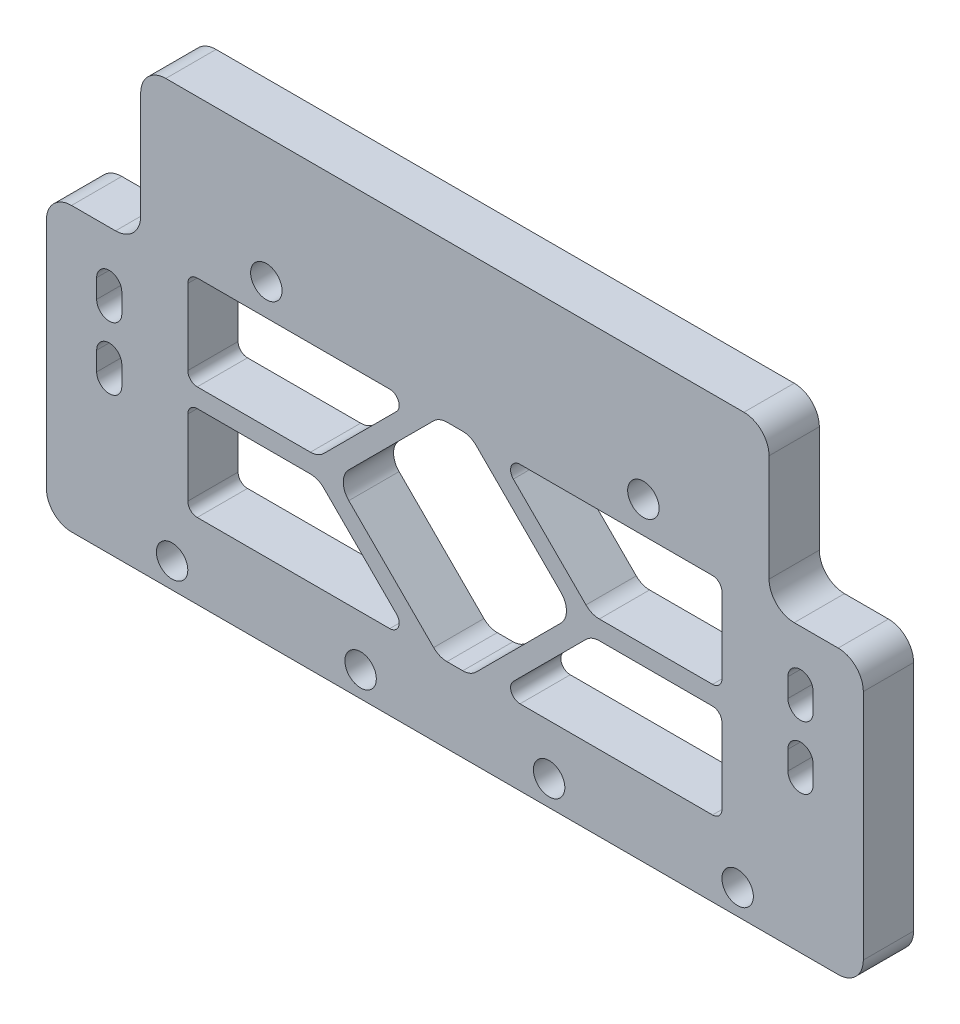
from build123d import *

# Parameters (mm, degrees)
BOSS_EXTRU_1_DEPTH      = 8
ESQUISSE2_R             = 2.5
ENL_V_MAT_EXTRU_1_DEPTH = 96.859271852
ENL_V_MAT_EXTRU_4_DEPTH = 96.859271852
ESQUISSE5_R             = 2.5
ENL_V_MAT_EXTRU_5_DEPTH = 96.859271852
ENL_V_MAT_EXTRU_6_DEPTH = 96.859271852


with BuildPart() as part:
    # Esquisse1 → Boss.-Extru.1 (new body)
    with BuildSketch(Plane.XY):
        with BuildLine():
            Line((65, 4), (65, 41))
            ThreePointArc((65, 41), (63.828427125, 43.828427125), (61, 45))
            Line((61, 45), (54, 45))
            ThreePointArc((54, 45), (51.171572875, 46.171572875), (50, 49))
            Line((50, 49), (50, 66))
            ThreePointArc((50, 66), (48.828427125, 68.828427125), (46, 70))
            Line((46, 70), (-46, 70))
            ThreePointArc((-46, 70), (-48.828427125, 68.828427125), (-50, 66))
            Line((-50, 66), (-50, 49))
            ThreePointArc((-50, 49), (-51.171572875, 46.171572875), (-54, 45))
            Line((-54, 45), (-61, 45))
            ThreePointArc((-61, 45), (-63.828427125, 43.828427125), (-65, 41))
            Line((-65, 41), (-65, 4))
            ThreePointArc((-65, 4), (-63.828427125, 1.171572875), (-61, 0))
            Line((-61, 0), (61, 0))
            ThreePointArc((61, 0), (63.828427125, 1.171572875), (65, 4))
        make_face()
    extrude(amount=BOSS_EXTRU_1_DEPTH)

    # Esquisse2 → Enlèv. mat.-Extru.1 (cut, through all)
    with BuildSketch(Plane.XY.offset(8)):
        with Locations((30, 50)):
            Circle(ESQUISSE2_R)
        with Locations(Location((-30, 50, 0), (0, 0, 180))):
            Circle(ESQUISSE2_R)
    extrude(amount=-ENL_V_MAT_EXTRU_1_DEPTH, mode=Mode.SUBTRACT)

    # Esquisse4 → Enlèv. mat.-Extru.4 (cut, through all)
    with BuildSketch(Plane.XY.offset(8)):
        with BuildLine():
            Line((-41, 45), (-10.363961031, 45))
            ThreePointArc((-10.363961031, 45), (-8.978141732, 44.074025149), (-9.303300859, 42.439339828))
            Line((-9.303300859, 42.439339828), (-20.863961031, 30.878679656))
            ThreePointArc((-20.863961031, 30.878679656), (-21.837231077, 30.228361402), (-22.985281374, 30))
            Line((-22.985281374, 30), (-41, 30))
            ThreePointArc((-41, 30), (-42.060660172, 30.439339828), (-42.5, 31.5))
            Line((-42.5, 31.5), (-42.5, 43.5))
            ThreePointArc((-42.5, 43.5), (-42.060660172, 44.560660172), (-41, 45))
        make_face()
        with BuildLine():
            Line((-41, 12), (-10.363961031, 12))
            ThreePointArc((-10.363961031, 12), (-8.978141732, 12.925974851), (-9.303300859, 14.560660172))
            Line((-9.303300859, 14.560660172), (-20.863961031, 26.121320344))
            ThreePointArc((-20.863961031, 26.121320344), (-21.837231077, 26.771638598), (-22.985281374, 27))
            Line((-22.985281374, 27), (-41, 27))
            ThreePointArc((-41, 27), (-42.060660172, 26.560660172), (-42.5, 25.5))
            Line((-42.5, 25.5), (-42.5, 13.5))
            ThreePointArc((-42.5, 13.5), (-42.060660172, 12.439339828), (-41, 12))
        make_face()
        with BuildLine():
            Line((42.5, 43.5), (42.5, 31.5))
            ThreePointArc((42.5, 31.5), (42.060660172, 30.439339828), (41, 30))
            Line((41, 30), (22.985281374, 30))
            ThreePointArc((22.985281374, 30), (21.837231077, 30.228361402), (20.863961031, 30.878679656))
            Line((20.863961031, 30.878679656), (9.303300859, 42.439339828))
            ThreePointArc((9.303300859, 42.439339828), (8.978141732, 44.074025149), (10.363961031, 45))
            Line((10.363961031, 45), (41, 45))
            ThreePointArc((41, 45), (42.060660172, 44.560660172), (42.5, 43.5))
        make_face()
        with BuildLine():
            Line((22.985281374, 27), (41, 27))
            ThreePointArc((41, 27), (42.060660172, 26.560660172), (42.5, 25.5))
            Line((42.5, 25.5), (42.5, 13.5))
            ThreePointArc((42.5, 13.5), (42.060660172, 12.439339828), (41, 12))
            Line((41, 12), (10.363961031, 12))
            ThreePointArc((10.363961031, 12), (8.978141732, 12.925974851), (9.303300859, 14.560660172))
            Line((9.303300859, 14.560660172), (20.863961031, 26.121320344))
            ThreePointArc((20.863961031, 26.121320344), (21.837231077, 26.771638598), (22.985281374, 27))
        make_face()
        with BuildLine():
            Line((-3.378679656, 44.121320344), (-16.878679656, 30.621320344))
            ThreePointArc((-16.878679656, 30.621320344), (-17.757359313, 28.5), (-16.878679656, 26.378679656))
            Line((-16.878679656, 26.378679656), (-3.378679656, 12.878679656))
            ThreePointArc((-3.378679656, 12.878679656), (-2.40540961, 12.228361402), (-1.257359313, 12))
            Line((-1.257359313, 12), (1.257359313, 12))
            ThreePointArc((1.257359313, 12), (2.40540961, 12.228361402), (3.378679656, 12.878679656))
            Line((3.378679656, 12.878679656), (16.878679656, 26.378679656))
            ThreePointArc((16.878679656, 26.378679656), (17.757359313, 28.5), (16.878679656, 30.621320344))
            Line((16.878679656, 30.621320344), (3.378679656, 44.121320344))
            ThreePointArc((3.378679656, 44.121320344), (2.40540961, 44.771638598), (1.257359313, 45))
            Line((1.257359313, 45), (-1.257359313, 45))
            ThreePointArc((-1.257359313, 45), (-2.40540961, 44.771638598), (-3.378679656, 44.121320344))
        make_face()
    extrude(amount=-ENL_V_MAT_EXTRU_4_DEPTH, mode=Mode.SUBTRACT)

    # Esquisse5 → Enlèv. mat.-Extru.5 (cut, through all)
    with BuildSketch(Plane.XY.offset(8)):
        with Locations((-45, 4)):
            Circle(ESQUISSE5_R)
        with Locations((-15, 4)):
            Circle(ESQUISSE5_R)
        with Locations((15, 4)):
            Circle(ESQUISSE5_R)
        with Locations((45, 4)):
            Circle(ESQUISSE5_R)
    extrude(amount=-ENL_V_MAT_EXTRU_5_DEPTH, mode=Mode.SUBTRACT)

    # Esquisse6 → Enlèv. mat.-Extru.6 (cut, through all)
    with BuildSketch(Plane.XY.offset(8)):
        with BuildLine():
            Line((57, 27.053539967), (57, 24.053539967))
            ThreePointArc((57, 24.053539967), (55, 22.053539967), (53, 24.053539967))
            Line((53, 24.053539967), (53, 27.053539967))
            ThreePointArc((53, 27.053539967), (55, 29.053539967), (57, 27.053539967))
        make_face()
        with BuildLine():
            Line((57, 34.053539967), (57, 37.053539967))
            ThreePointArc((57, 37.053539967), (55, 39.053539967), (53, 37.053539967))
            Line((53, 37.053539967), (53, 34.053539967))
            ThreePointArc((53, 34.053539967), (55, 32.053539967), (57, 34.053539967))
        make_face()
        with BuildLine():
            Line((-57, 34.053539967), (-57, 37.053539967))
            ThreePointArc((-57, 37.053539967), (-55, 39.053539967), (-53, 37.053539967))
            Line((-53, 37.053539967), (-53, 34.053539967))
            ThreePointArc((-53, 34.053539967), (-55, 32.053539967), (-57, 34.053539967))
        make_face()
        with BuildLine():
            Line((-57, 27.053539967), (-57, 24.053539967))
            ThreePointArc((-57, 24.053539967), (-55, 22.053539967), (-53, 24.053539967))
            Line((-53, 24.053539967), (-53, 27.053539967))
            ThreePointArc((-53, 27.053539967), (-55, 29.053539967), (-57, 27.053539967))
        make_face()
    extrude(amount=-ENL_V_MAT_EXTRU_6_DEPTH, mode=Mode.SUBTRACT)


solid = part.part
